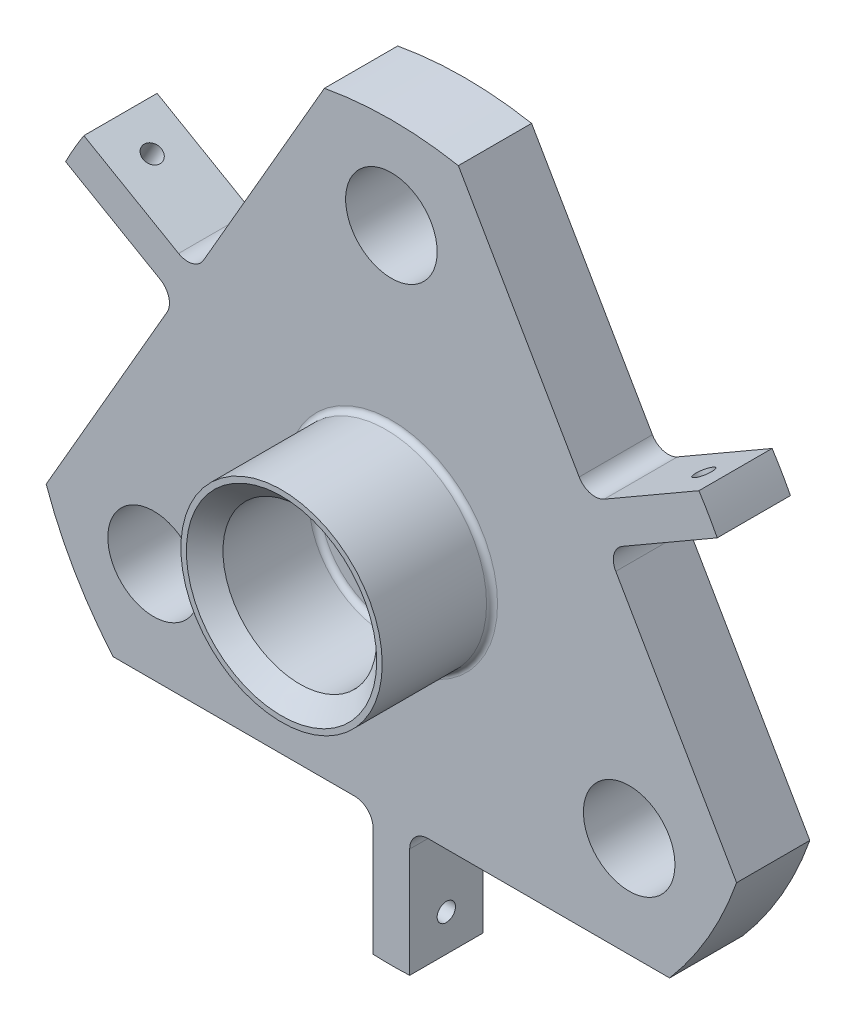
from build123d import *

# Parameters (mm, degrees)
SKETCH1_R           = 27.5
SKETCH1_R_2         = 21
BOSS_EXTRUDE1_DEPTH = 50
SKETCH1_3_R         = 100
SKETCH1_3_R_2       = 27.5
SKETCH1_3_R_3       = 21
BOSS_EXTRUDE2_DEPTH = 20
CHAMFER1_SIZE       = 5
FILLET1_R           = 1.5
SKETCH10_R          = 12.5
CUT_EXTRUDE1_DEPTH  = 20
SKETCH12_W          = 90
SKETCH12_H          = 35
CUT_EXTRUDE3_DEPTH  = 151
SKETCH13_R          = 2.5
CUT_EXTRUDE4_DEPTH  = 151.840188116
SKETCH14_R          = 2.5
CUT_EXTRUDE5_DEPTH  = 150.526515224
SKETCH15_R          = 2.5
CUT_EXTRUDE6_DEPTH  = 151.840188116


with BuildPart() as part:
    # Sketch1 → Boss-Extrude1 (new body)
    with BuildSketch(Plane.XY):
        Circle(SKETCH1_R)
        Circle(SKETCH1_R_2, mode=Mode.SUBTRACT)
    extrude(amount=BOSS_EXTRUDE1_DEPTH)

    # Sketch1<3> → Boss-Extrude2 (add)
    # profile 1 of 2: a face of its own
    with BuildSketch(Plane.XY):
        Circle(SKETCH1_3_R)
        Circle(SKETCH1_3_R_2, mode=Mode.SUBTRACT)
    # profile 2 of 2: a face of its own
    with BuildSketch(Plane.XY):
        Circle(SKETCH1_3_R_3)
    extrude(amount=BOSS_EXTRUDE2_DEPTH)

    # Chamfer1
    chamfer1_edges = [part.edges().sort_by_distance(p)[0] for p in [
        (-21, 0, 50),
    ]]
    chamfer(chamfer1_edges, length=CHAMFER1_SIZE)

    # Fillet1
    fillet1_edges = [part.edges().sort_by_distance(p)[0] for p in [
        (-27.5, 0, 20),
        (-21, 0, 20),
    ]]
    fillet(fillet1_edges, radius=FILLET1_R)

    # Sketch10 → Cut-Extrude1 (cut)
    with BuildSketch(Plane.XY.offset(20)):
        with Locations((0, 75)):
            Circle(SKETCH10_R)
        with Locations((64.951905284, -37.5)):
            Circle(SKETCH10_R)
        with Locations((-64.951905284, -37.5)):
            Circle(SKETCH10_R)
    extrude(amount=-CUT_EXTRUDE1_DEPTH, mode=Mode.SUBTRACT)

    # Sketch12 → Cut-Extrude3 (cut, through all)
    with BuildSketch(Plane(origin=(0, 0, 0), x_dir=(-1, 0, 0), z_dir=(0, 0, -1))):
        with BuildLine():
            Line((-15, -130), (-15, -70))
            ThreePointArc((-15, -70), (-10, -65), (-5, -70))
            Line((-5, -70), (-5, -130))
            ThreePointArc((-5, -130), (-10, -135), (-15, -130))
        make_face()
        Polygon((-61.291651246, 23.839745962), (-91.602540378, 41.339745962), (-136.602540378, -36.602540378), (-106.291651246, -54.102540378), align=None)
        with BuildLine():
            Line((5, -130), (5, -70))
            ThreePointArc((5, -70), (10, -65), (15, -70))
            Line((15, -70), (15, -130))
            ThreePointArc((15, -130), (10, -135), (5, -130))
        make_face()
        with Locations((-55, -82.5)):
            Rectangle(SKETCH12_W, SKETCH12_H)
        with Locations((55, -82.5)):
            Rectangle(SKETCH12_W, SKETCH12_H)
        Polygon((-51.291651246, 41.160254038), (-81.602540378, 58.660254038), (-36.602540378, 136.602540378), (-6.291651246, 119.102540378), align=None)
        with BuildLine():
            Line((-110.083302492, 69.330127019), (-58.121778265, 39.330127019))
            ThreePointArc((-58.121778265, 39.330127019), (-51.291651246, 41.160254038), (-53.121778265, 47.990381057))
            Line((-53.121778265, 47.990381057), (-105.083302492, 77.990381057))
            ThreePointArc((-105.083302492, 77.990381057), (-111.913429511, 76.160254038), (-110.083302492, 69.330127019))
        make_face()
        with BuildLine():
            Line((-120.083302492, 52.009618943), (-68.121778265, 22.009618943))
            ThreePointArc((-68.121778265, 22.009618943), (-61.291651246, 23.839745962), (-63.121778265, 30.669872981))
            Line((-63.121778265, 30.669872981), (-115.083302492, 60.669872981))
            ThreePointArc((-115.083302492, 60.669872981), (-121.913429511, 58.839745962), (-120.083302492, 52.009618943))
        make_face()
        Polygon((51.291651246, 41.160254038), (81.602540378, 58.660254038), (36.602540378, 136.602540378), (6.291651246, 119.102540378), align=None)
        Polygon((61.291651246, 23.839745962), (91.602540378, 41.339745962), (136.602540378, -36.602540378), (106.291651246, -54.102540378), align=None)
        with BuildLine():
            Line((115.083302492, 60.669872981), (63.121778265, 30.669872981))
            ThreePointArc((63.121778265, 30.669872981), (61.291651246, 23.839745962), (68.121778265, 22.009618943))
            Line((68.121778265, 22.009618943), (120.083302492, 52.009618943))
            ThreePointArc((120.083302492, 52.009618943), (121.913429511, 58.839745962), (115.083302492, 60.669872981))
        make_face()
        with BuildLine():
            Line((105.083302492, 77.990381057), (53.121778265, 47.990381057))
            ThreePointArc((53.121778265, 47.990381057), (51.291651246, 41.160254038), (58.121778265, 39.330127019))
            Line((58.121778265, 39.330127019), (110.083302492, 69.330127019))
            ThreePointArc((110.083302492, 69.330127019), (111.913429511, 76.160254038), (105.083302492, 77.990381057))
        make_face()
    extrude(amount=-CUT_EXTRUDE3_DEPTH, mode=Mode.SUBTRACT)

    # Sketch13 → Cut-Extrude4 (cut, through all)
    with BuildSketch(Plane(origin=(2.5, -4.330127019, 0), x_dir=(0.8660254037844378, 0.5000000000000017, 0), z_dir=(0.5000000000000016, -0.8660254037844377, 0))):
        with Locations((89.874921777, 10)):
            Circle(SKETCH13_R)
    extrude(amount=-CUT_EXTRUDE4_DEPTH, mode=Mode.SUBTRACT)

    # Sketch14 → Cut-Extrude5 (cut, through all)
    with BuildSketch(Plane.ZY.offset(5)):
        with Locations((10, -89.874921777)):
            Circle(SKETCH14_R)
    extrude(amount=-CUT_EXTRUDE5_DEPTH, mode=Mode.SUBTRACT)

    # Sketch15 → Cut-Extrude6 (cut, through all)
    with BuildSketch(Plane(origin=(-2.5, -4.330127019, 0), x_dir=(0.8660254037844392, -0.49999999999999906, 0), z_dir=(-0.49999999999999906, -0.8660254037844392, 0))):
        with Locations((-89.874921777, 10)):
            Circle(SKETCH15_R)
    extrude(amount=-CUT_EXTRUDE6_DEPTH, mode=Mode.SUBTRACT)


solid = part.part
